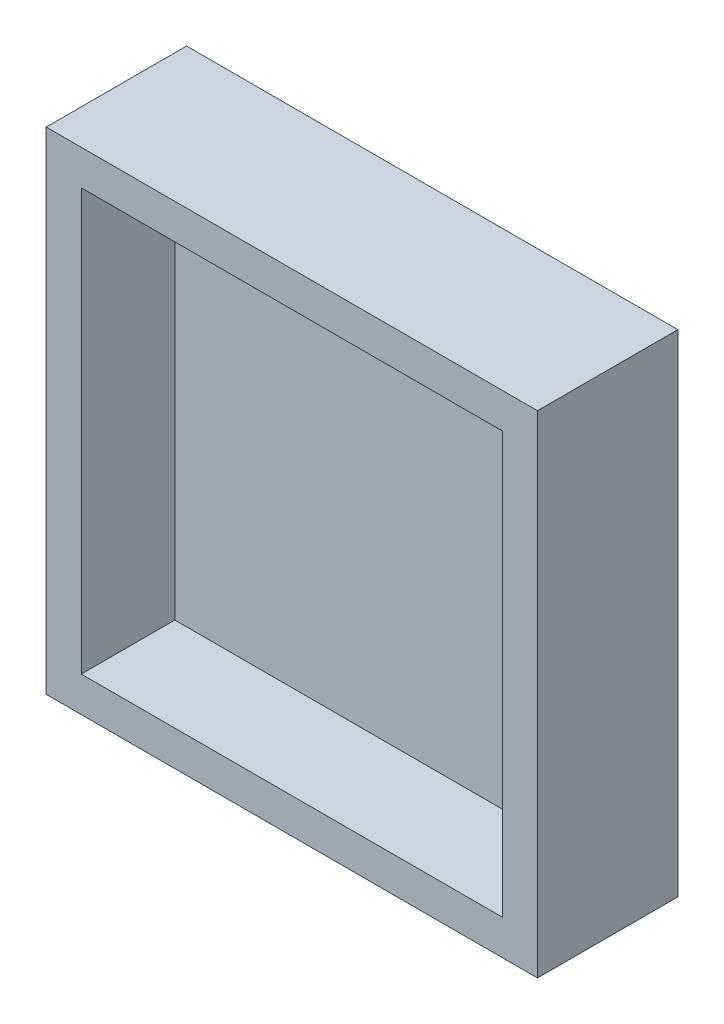
from build123d import *

# Parameters (mm, degrees)
SKETCH1_W           = 133.35
SKETCH1_H           = 133.35
BOSS_EXTRUDE1_DEPTH = 38.1
SKETCH2_W           = 114.3
SKETCH2_H           = 114.3
CUT_EXTRUDE1_DEPTH  = 25.4


with BuildPart() as part:
    # Sketch1 → Boss-Extrude1 (new body)
    with BuildSketch(Plane.XY):
        Rectangle(SKETCH1_W, SKETCH1_H)
    extrude(amount=BOSS_EXTRUDE1_DEPTH)

    # Sketch2 → Cut-Extrude1 (cut)
    with BuildSketch(Plane.XY.offset(38.1)):
        Rectangle(SKETCH2_W, SKETCH2_H)
    extrude(amount=-CUT_EXTRUDE1_DEPTH, mode=Mode.SUBTRACT)


solid = part.part
